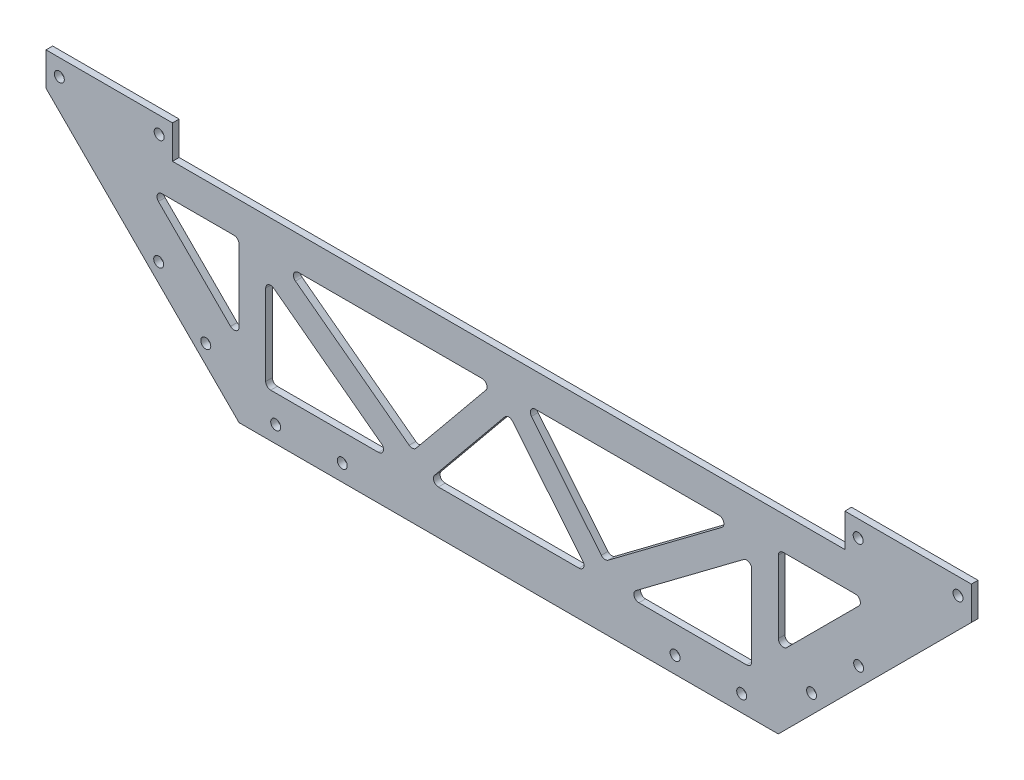
from build123d import *

# Parameters (mm, degrees)
SKETCH_1_R               = 1.5
EXTRUDE_1_DEPTH          = 2
SKETCH_2_R               = 1.5
CUT_EXTRUDE_1_DEPTH      = 151.628682528
SKETCH_3_W               = 278
SKETCH_3_H               = 20
CUT_EXTRUDE_2_DEPTH      = 151.628682528
CUT_EXTRUDE_3_DEPTH      = 151.628682528
CUT_EXTRUDE_3_DEPTH_BACK = 151.628682528


with BuildPart() as part:
    # 草图1 → 凸台-拉伸1 (new body)
    with BuildSketch(Plane.XY):
        Polygon((-101, 30), (-101, 0), (101, 0), (101, 30), (139, 30), (139, 0), (81, -58), (-81, -58), (-139, 0), (-139, 30), align=None)
        with Locations((-135, 25)):
            Circle(SKETCH_1_R, mode=Mode.SUBTRACT)
        with Locations((-105, 25)):
            Circle(SKETCH_1_R, mode=Mode.SUBTRACT)
        with Locations((-105, 5)):
            Circle(SKETCH_1_R, mode=Mode.SUBTRACT)
        with Locations((-135, 5)):
            Circle(SKETCH_1_R, mode=Mode.SUBTRACT)
        with Locations(Location((135, 5, 0), (0, 0, 180))):
            Circle(SKETCH_1_R, mode=Mode.SUBTRACT)
        with Locations(Location((105, 5, 0), (0, 0, 180))):
            Circle(SKETCH_1_R, mode=Mode.SUBTRACT)
        with Locations(Location((105, 25, 0), (0, 0, 180))):
            Circle(SKETCH_1_R, mode=Mode.SUBTRACT)
        with Locations(Location((135, 25, 0), (0, 0, 180))):
            Circle(SKETCH_1_R, mode=Mode.SUBTRACT)
        with Locations((-70, -53)):
            Circle(SKETCH_1_R, mode=Mode.SUBTRACT)
        with Locations((-50, -53)):
            Circle(SKETCH_1_R, mode=Mode.SUBTRACT)
        with Locations(Location((50, -53, 0), (0, 0, 180))):
            Circle(SKETCH_1_R, mode=Mode.SUBTRACT)
        with Locations(Location((70, -53, 0), (0, 0, 180))):
            Circle(SKETCH_1_R, mode=Mode.SUBTRACT)
    extrude(amount=EXTRUDE_1_DEPTH)

    # 草图2 → 切除-拉伸1 (cut, through all)
    with BuildSketch(Plane.XY.offset(2)):
        with Locations((-105.142135624, -28.201010127)):
            Circle(SKETCH_2_R)
        with Locations((-91, -42.343145751)):
            Circle(SKETCH_2_R)
        with Locations(Location((91, -42.343145751, 0), (0, 0, 180))):
            Circle(SKETCH_2_R)
        with Locations(Location((105.142135624, -28.201010127, 0), (0, 0, 180))):
            Circle(SKETCH_2_R)
    extrude(amount=-CUT_EXTRUDE_1_DEPTH, mode=Mode.SUBTRACT)

    # 草图3 → 切除-拉伸2 (cut, through all)
    with BuildSketch(Plane.XY.offset(2)):
        with Locations((0, 20)):
            Rectangle(SKETCH_3_W, SKETCH_3_H)
    extrude(amount=-CUT_EXTRUDE_2_DEPTH, mode=Mode.SUBTRACT)

    # 草图4 → 切除-拉伸3 (cut, two sides: drawn at the far end of the back side and taken through both)
    with BuildSketch(Plane.XY.offset(2).offset(-CUT_EXTRUDE_3_DEPTH_BACK)):
        with BuildLine():
            Line((-105.226136393, -12.560660172), (-83.560660172, -34.226136393))
            ThreePointArc((-83.560660172, -34.226136393), (-81.925974851, -34.55129552), (-81, -33.165476221))
            Line((-81, -33.165476221), (-81, -11.5))
            ThreePointArc((-81, -11.5), (-81.439339828, -10.439339828), (-82.5, -10))
            Line((-82.5, -10), (-104.165476221, -10))
            ThreePointArc((-104.165476221, -10), (-105.55129552, -10.925974851), (-105.226136393, -12.560660172))
        make_face()
        with BuildLine():
            Line((-73, -19), (-73, -43.286796564))
            ThreePointArc((-73, -43.286796564), (-72.560660172, -44.347456736), (-71.5, -44.786796564))
            Line((-71.5, -44.786796564), (-39.117604581, -44.786796564))
            ThreePointArc((-39.117604581, -44.786796564), (-37.694579634, -43.761138213), (-38.217604581, -42.086796564))
            Line((-38.217604581, -42.086796564), (-70.6, -17.8))
            ThreePointArc((-70.6, -17.8), (-72.170820393, -17.658359214), (-73, -19))
        make_face()
        with BuildLine():
            Line((-63.166666667, -10), (-8, -10))
            ThreePointArc((-8, -10), (-6.644239805, -10.858194505), (-6.839820875, -12.450780941))
            Line((-6.839820875, -12.450780941), (-27.839820875, -38.075780941))
            ThreePointArc((-27.839820875, -38.075780941), (-28.819858864, -38.614143771), (-29.9, -38.325))
            Line((-29.9, -38.325), (-64.066666667, -12.7))
            ThreePointArc((-64.066666667, -12.7), (-64.589691614, -11.025658351), (-63.166666667, -10))
        make_face()
        with BuildLine():
            Line((29.9, -38.325), (64.066666667, -12.7))
            ThreePointArc((64.066666667, -12.7), (64.589691614, -11.025658351), (63.166666667, -10))
            Line((63.166666667, -10), (8, -10))
            ThreePointArc((8, -10), (6.644239805, -10.858194505), (6.839820875, -12.450780941))
            Line((6.839820875, -12.450780941), (27.839820875, -38.075780941))
            ThreePointArc((27.839820875, -38.075780941), (28.819858864, -38.614143771), (29.9, -38.325))
        make_face()
        with BuildLine():
            Line((38.217604581, -42.086796564), (70.6, -17.8))
            ThreePointArc((70.6, -17.8), (72.170820393, -17.658359214), (73, -19))
            Line((73, -19), (73, -43.286796564))
            ThreePointArc((73, -43.286796564), (72.560660172, -44.347456736), (71.5, -44.786796564))
            Line((71.5, -44.786796564), (39.117604581, -44.786796564))
            ThreePointArc((39.117604581, -44.786796564), (37.694579634, -43.761138213), (38.217604581, -42.086796564))
        make_face()
        with BuildLine():
            Line((82.5, -10), (104.165476221, -10))
            ThreePointArc((104.165476221, -10), (105.55129552, -10.925974851), (105.226136393, -12.560660172))
            Line((105.226136393, -12.560660172), (83.560660172, -34.226136393))
            ThreePointArc((83.560660172, -34.226136393), (81.925974851, -34.55129552), (81, -33.165476221))
            Line((81, -33.165476221), (81, -11.5))
            ThreePointArc((81, -11.5), (81.439339828, -10.439339828), (82.5, -10))
        make_face()
        with BuildLine():
            Line((-22.280808546, -42.336015623), (-1.160179125, -16.563819008))
            ThreePointArc((-1.160179125, -16.563819008), (0, -16.014599949), (1.160179125, -16.563819008))
            Line((1.160179125, -16.563819008), (22.280808546, -42.336015623))
            ThreePointArc((22.280808546, -42.336015623), (22.476389616, -43.92860206), (21.120629421, -44.786796564))
            Line((21.120629421, -44.786796564), (-21.120629421, -44.786796564))
            ThreePointArc((-21.120629421, -44.786796564), (-22.476389616, -43.92860206), (-22.280808546, -42.336015623))
        make_face()
    extrude(amount=CUT_EXTRUDE_3_DEPTH + CUT_EXTRUDE_3_DEPTH_BACK, mode=Mode.SUBTRACT)


solid = part.part
